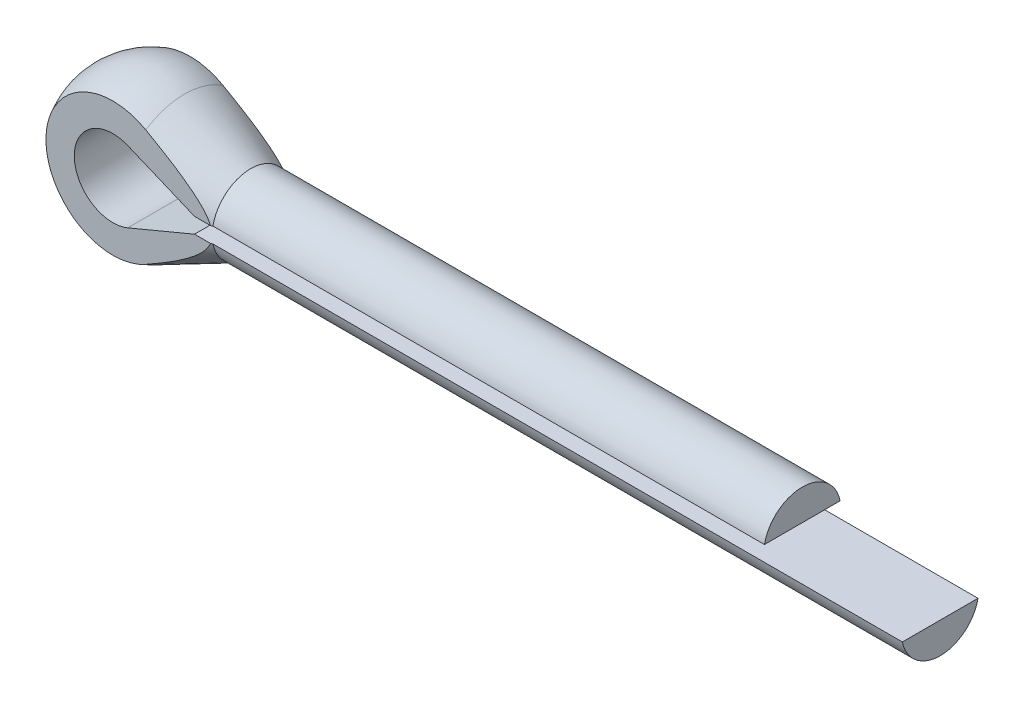
from build123d import *

# Parameters (mm, degrees)
CUT_EXTRUDE1_DEPTH      = 13.655828697
CUT_EXTRUDE1_DEPTH_BACK = 13.655828697
CUT_EXTRUDE2_DEPTH      = 13.597618823
CUT_EXTRUDE2_DEPTH_BACK = 13.597618823


with BuildPart() as part:
    # Sketch1 → Revolve1 (revolve)
    with BuildSketch(Plane.XY, mode=Mode.PRIVATE) as revolve1_sk:
        with BuildLine():
            Line((0, 0.7), (-1.203701126, 1.266660038))
            ThreePointArc((-1.203701126, 1.266660038), (-2.550060523, 1.182120642), (-3.2, 0))
            Line((-3.2, 0), (12.5, 0))
            Line((12.5, 0), (12.5, 0.7))
            Line((12.5, 0.7), (0, 0.7))
        make_face()
    revolve(revolve1_sk.sketch.rotate(Axis((0, 0, 0), (1, 0, 0)), 90), axis=Axis((0, 0, 0), (1, 0, 0)))

    # Sketch2 → Cut-Extrude1 (cut, two sides: drawn at the far end of the back side and taken through both)
    with BuildSketch(Plane(origin=(0, 0, 0), x_dir=(1, 0, 0), z_dir=(0, 1, 0)).offset(-CUT_EXTRUDE1_DEPTH_BACK)):
        with BuildLine():
            Line((-3.012435565, 0.7), (0, 0.7))
            Line((0, 0.7), (-1.203701126, 1.266660038))
            ThreePointArc((-1.203701126, 1.266660038), (-2.218547495, 1.335970806), (-3.012435565, 0.7))
        make_face()
        with BuildLine():
            Line((-3.012435565, -0.7), (0, -0.7))
            Line((0, -0.7), (-1.203701126, -1.266660038))
            ThreePointArc((-1.203701126, -1.266660038), (-2.218547495, -1.335970806), (-3.012435565, -0.7))
        make_face()
    extrude(amount=CUT_EXTRUDE1_DEPTH + CUT_EXTRUDE1_DEPTH_BACK, mode=Mode.SUBTRACT)

    # Sketch3 → Cut-Extrude2 (cut, two sides: drawn at the far end of the back side and taken through both)
    with BuildSketch(Plane.XY.offset(-CUT_EXTRUDE2_DEPTH_BACK)):
        with BuildLine():
            Line((-1.530011672, 0.645837675), (-0.32, 0.14))
            Line((-0.32, 0.14), (10, 0.14))
            Line((10, 0.14), (10, 0.7))
            Line((10, 0.7), (12.5, 0.7))
            Line((12.5, 0.7), (12.5, -0.14))
            Line((12.5, -0.14), (-0.32, -0.14))
            Line((-0.32, -0.14), (-1.530011672, -0.645837675))
            ThreePointArc((-1.530011672, -0.645837675), (-2.5, 0), (-1.530011672, 0.645837675))
        make_face()
    extrude(amount=CUT_EXTRUDE2_DEPTH + CUT_EXTRUDE2_DEPTH_BACK, mode=Mode.SUBTRACT)


solid = part.part
